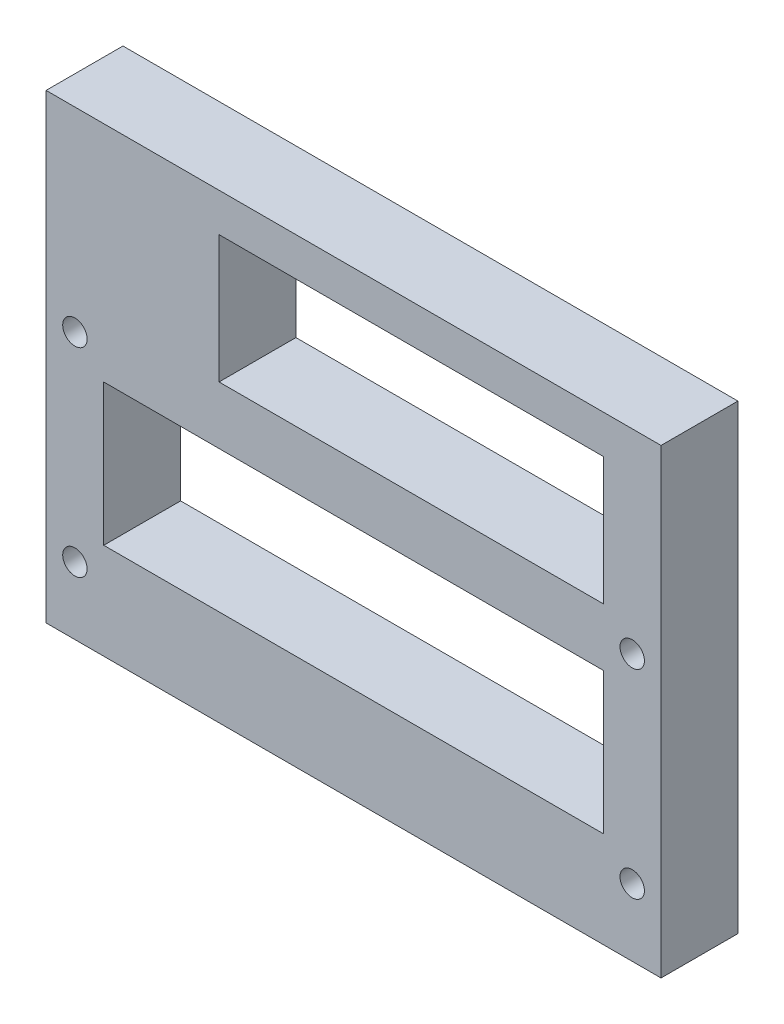
from build123d import *

# Parameters (mm, degrees)
SKETCH1_W           = 80
SKETCH1_H           = 60
SKETCH1_W_2         = 50
SKETCH1_H_2         = 16.6
SKETCH1_R           = 1.5875
SKETCH1_W_3         = 65
SKETCH1_H_3         = 18.4
BOSS_EXTRUDE1_DEPTH = 10


with BuildPart() as part:
    # Sketch1 → Boss-Extrude1 (new body)
    with BuildSketch(Plane.XY):
        with Locations((32.5, 17.5)):
            Rectangle(SKETCH1_W, SKETCH1_H)
        with Locations((40, 34.2)):
            Rectangle(SKETCH1_W_2, SKETCH1_H_2, mode=Mode.SUBTRACT)
        with Locations((-3.75, -3.75)):
            Circle(SKETCH1_R, mode=Mode.SUBTRACT)
        with Locations((68.75, -3.75)):
            Circle(SKETCH1_R, mode=Mode.SUBTRACT)
        with Locations((-3.75, 22.15)):
            Circle(SKETCH1_R, mode=Mode.SUBTRACT)
        with Locations((32.5, 9.2)):
            Rectangle(SKETCH1_W_3, SKETCH1_H_3, mode=Mode.SUBTRACT)
        with Locations((68.75, 22.15)):
            Circle(SKETCH1_R, mode=Mode.SUBTRACT)
    extrude(amount=BOSS_EXTRUDE1_DEPTH)


solid = part.part
